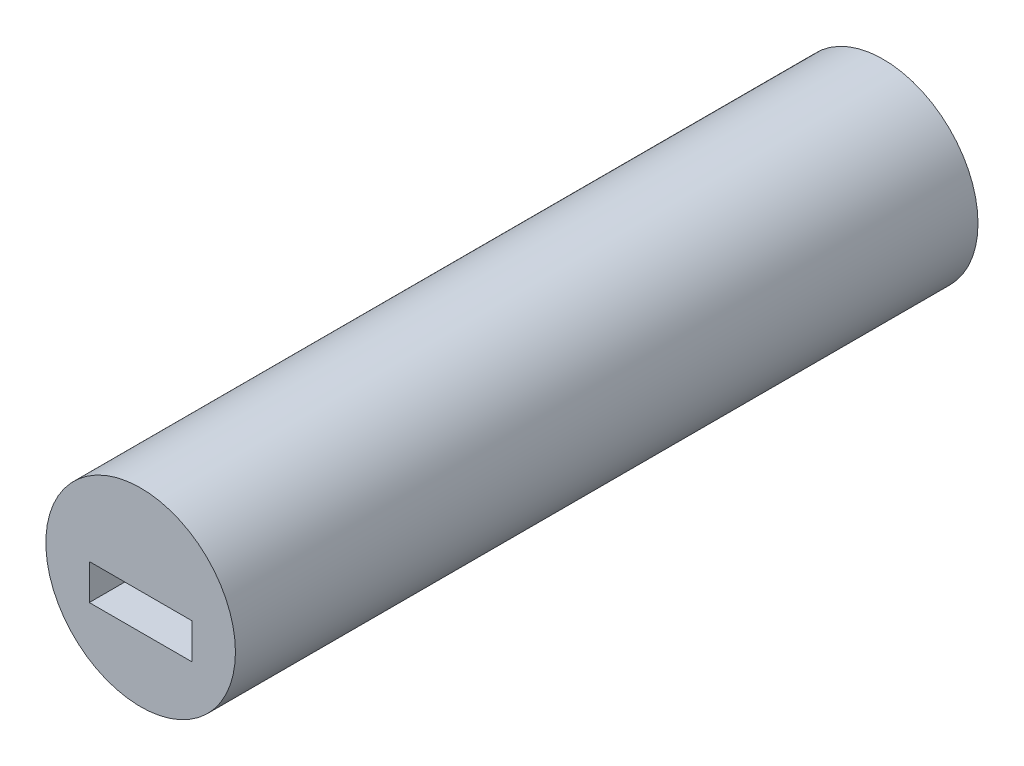
from build123d import *

# Parameters (mm, degrees)
CROQUIS1_R              = 12
SALIENTE_EXTRUIR1_DEPTH = 69
CROQUIS2_R              = 12
CROQUIS2_W              = 13
CROQUIS2_H              = 4.5
SALIENTE_EXTRUIR2_DEPTH = 25


with BuildPart() as part:
    # Croquis1 → Saliente-Extruir1 (new body)
    with BuildSketch(Plane.XY):
        Circle(CROQUIS1_R)
    extrude(amount=SALIENTE_EXTRUIR1_DEPTH)

    # Croquis2 → Saliente-Extruir2 (add)
    with BuildSketch(Plane.XY.offset(69)):
        Circle(CROQUIS2_R)
        with Locations((0, -1.565571557)):
            Rectangle(CROQUIS2_W, CROQUIS2_H, mode=Mode.SUBTRACT)
    extrude(amount=SALIENTE_EXTRUIR2_DEPTH)


solid = part.part
